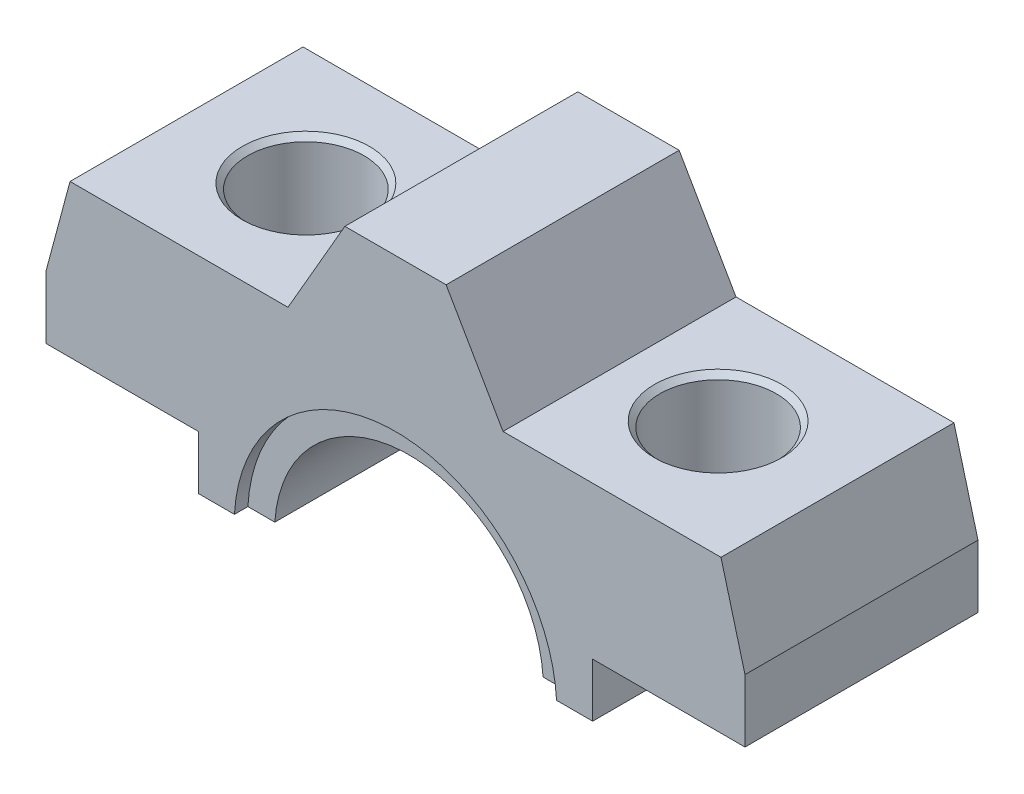
from build123d import *

# Parameters (mm, degrees)
EXTRUDE_1_DEPTH     = 26
SKETCH_2_R          = 15
CUT_EXTRUDE_1_DEPTH = 59.497863209
SKETCH_3_R          = 18
CUT_EXTRUDE_2_DEPTH = 1.5
CUT_EXTRUDE_START   = -1.5
SKETCH_4_R          = 18
CUT_EXTRUDE_3_DEPTH = 1.5
EXTRUDE_2_DEPTH     = 26
SKETCH_6_R          = 6.5
CUT_EXTRUDE_5_DEPTH = 53.211109929
CHAMFER_1_SIZE      = 0.6


with BuildPart() as part:
    # Эскиз1 → Бобышка-Вытянуть1 (new body)
    with BuildSketch(Plane.XY):
        with BuildLine():
            Line((-35.09985755, 24), (-12, 24))
            Line((-12, 24), (-5.649147039, 35))
            Line((-5.649147039, 35), (5.649147039, 35))
            Line((5.649147039, 35), (12, 24))
            Line((12, 24), (35.09985755, 24))
            ThreePointArc((35.09985755, 24), (38.012461407, 15.720824375), (39, 7))
            Line((39, 7), (22, 7))
            Line((22, 7), (22, 1))
            Line((22, 1), (-22, 1))
            Line((-22, 1), (-22, 7))
            Line((-22, 7), (-39, 7))
            ThreePointArc((-39, 7), (-38.012461407, 15.720824375), (-35.09985755, 24))
        make_face()
    extrude(amount=-EXTRUDE_1_DEPTH)

    # Эскиз2 → Вырез-Вытянуть1 (cut, through all)
    with BuildSketch(Plane.XY):
        Circle(SKETCH_2_R)
    extrude(amount=-CUT_EXTRUDE_1_DEPTH, mode=Mode.SUBTRACT)

    # Эскиз3 → Вырез-Вытянуть2 (cut)
    with BuildSketch(Plane.XY):
        Circle(SKETCH_3_R)
    extrude(amount=-CUT_EXTRUDE_2_DEPTH, mode=Mode.SUBTRACT)

    # Эскиз4 → Вырез-Вытянуть3 (cut)
    with BuildSketch(Plane(origin=(0, 0, -26), x_dir=(-1, 0, 0), z_dir=(0, 0, -1)).offset(CUT_EXTRUDE_START)):
        Circle(SKETCH_4_R)
    extrude(amount=CUT_EXTRUDE_3_DEPTH, mode=Mode.SUBTRACT)

    # Эскиз9 → Бобышка-Вытянуть2 (add)
    with BuildSketch(Plane.XY):
        Polygon((-39, 7), (-39, 14), (-36.320508076, 24), (-22, 24), (-22, 7), align=None)
        Polygon((39, 7), (39, 14), (36.320508076, 24), (22, 24), (22, 7), align=None)
    extrude(amount=-EXTRUDE_2_DEPTH)

    # Эскиз6 → Вырез-Вытянуть5 (cut, through all)
    with BuildSketch(Plane(origin=(0, 24, 0), x_dir=(1, 0, 0), z_dir=(0, 1, 0))):
        with Locations(Location((-23, 13, 0), (0, 0, 270))):
            Circle(SKETCH_6_R)
        with Locations(Location((23, 13, 0), (0, 0, 270))):
            Circle(SKETCH_6_R)
    extrude(amount=-CUT_EXTRUDE_5_DEPTH, mode=Mode.SUBTRACT)

    # Фаска1
    chamfer_1_edges = [part.edges().sort_by_distance(p)[0] for p in [
        (-23, 24, -19.5),
        (23, 24, -19.5),
    ]]
    chamfer(chamfer_1_edges, length=CHAMFER_1_SIZE)


solid = part.part
